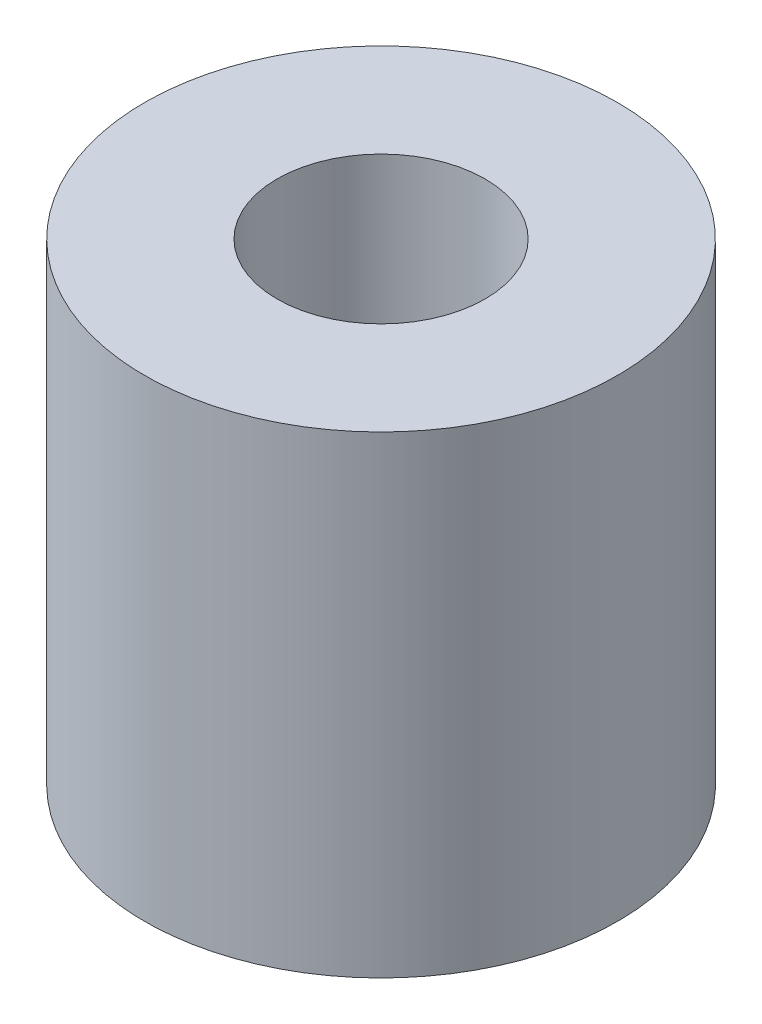
from build123d import *

# Parameters (mm, degrees)
SKETCH1_R           = 4.7625
SKETCH1_R_2         = 2.0955
BOSS_EXTRUDE1_DEPTH = 9.525


with BuildPart() as part:
    # Sketch1 → Boss-Extrude1 (new body)
    with BuildSketch(Plane(origin=(0, 0, 0), x_dir=(1, 0, 0), z_dir=(0, 1, 0))):
        with Locations(Location((0, 0, 0), (0, 0, 90))):
            Circle(SKETCH1_R)
        with Locations(Location((0, 0, 0), (0, 0, 90))):
            Circle(SKETCH1_R_2, mode=Mode.SUBTRACT)
    extrude(amount=BOSS_EXTRUDE1_DEPTH)


solid = part.part
